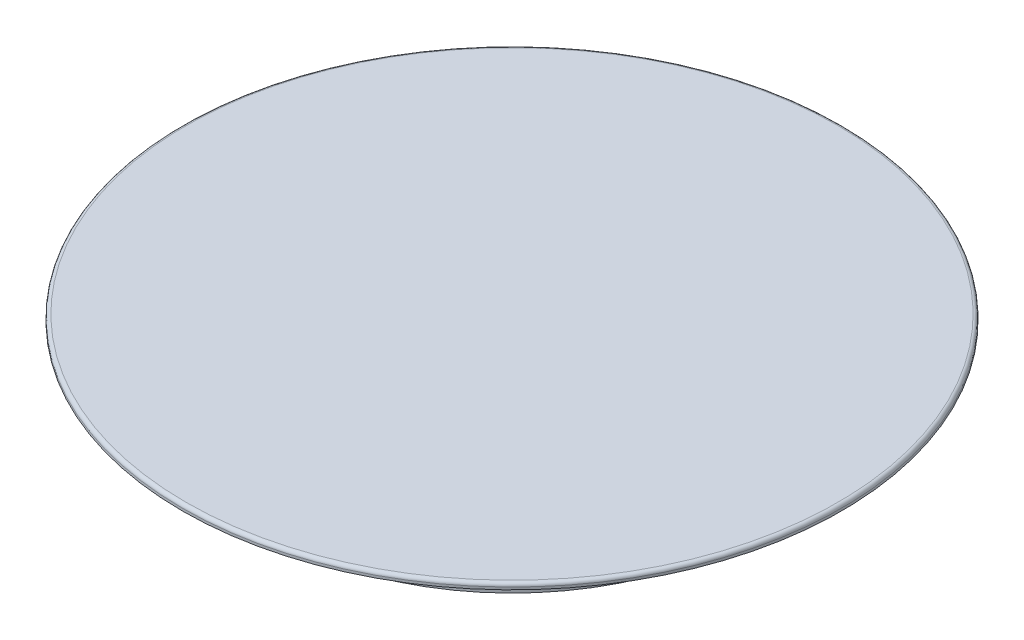
from build123d import *

# Parameters (mm, degrees)
SKETCH1_R           = 95
BOSS_EXTRUDE1_DEPTH = 1.7
FILLET1_R           = 1
SKETCH2_R           = 70
BOSS_EXTRUDE2_DEPTH = 18.5
DRAFT3_ANGLE        = -2


with BuildPart() as part:
    # Sketch1 → Boss-Extrude1 (new body)
    with BuildSketch(Plane(origin=(0, 0, 0), x_dir=(1, 0, 0), z_dir=(0, 1, 0))):
        with Locations(Location((0, 0, 0), (0, 0, 270))):
            Circle(SKETCH1_R)
    extrude(amount=BOSS_EXTRUDE1_DEPTH)

    # Fillet1
    fillet1_edges = [part.edges().sort_by_distance(p)[0] for p in [
        (0, 1.7, -95),
    ]]
    fillet(fillet1_edges, radius=FILLET1_R)

    # Sketch2 → Boss-Extrude2 (add)
    with BuildSketch(Plane.XZ):
        with Locations(Location((0, 0, 0), (0, 0, 270))):
            Circle(SKETCH2_R)
    extrude(amount=BOSS_EXTRUDE2_DEPTH)

    # Draft3
    draft3_faces = [part.faces().sort_by_distance(p)[0] for p in [
        (0, -9.25, 70),
    ]]
    draft(draft3_faces, Plane(origin=(0, -18.5, 0), x_dir=(0, 0, -1), z_dir=(0, -1, 0)), DRAFT3_ANGLE)


solid = part.part
